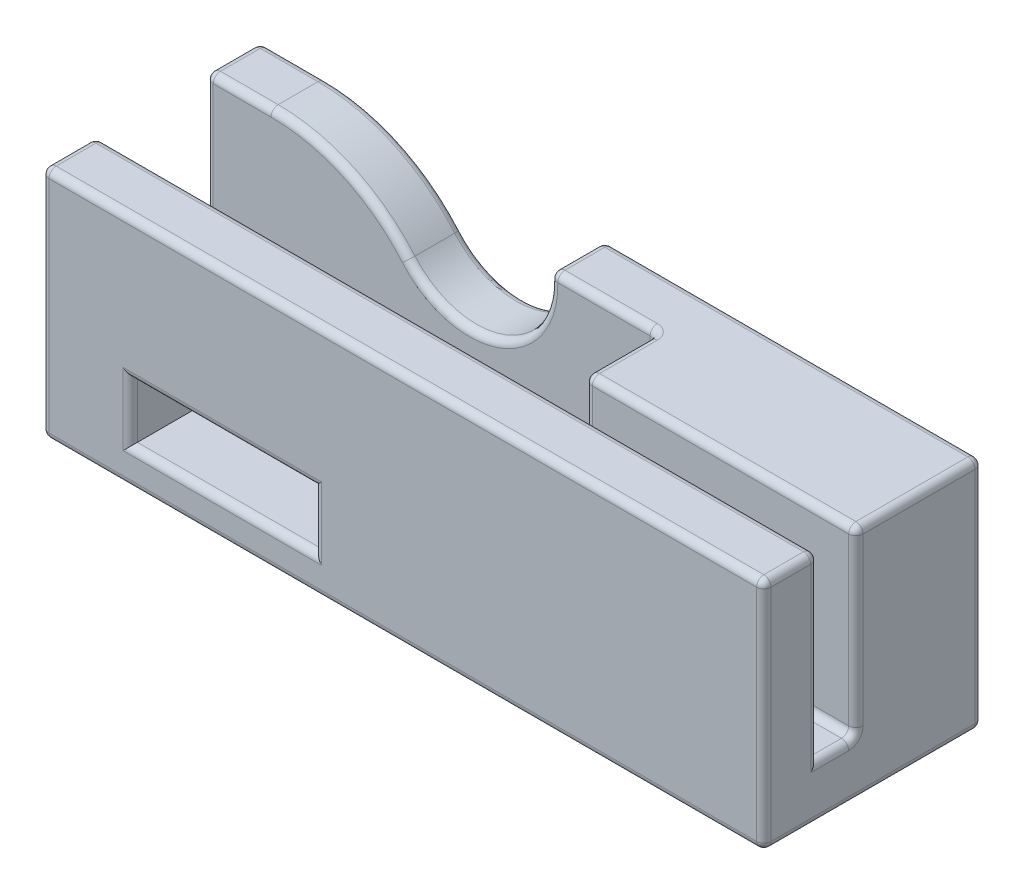
from build123d import *

# Parameters (mm, degrees)
SKETCH1_W           = 40
SKETCH1_H           = 12.1
BOSS_EXTRUDE1_DEPTH = 3
SKETCH2_W           = 40
SKETCH2_H           = 7
SKETCH2_H_2         = 3
BOSS_EXTRUDE2_DEPTH = 10
SKETCH3_W           = 10.2
SKETCH3_H           = 3.2
CUT_EXTRUDE1_DEPTH  = 44.765397291
SKETCH5_W           = 4
SKETCH5_H           = 10
CUT_EXTRUDE3_DEPTH  = 25
SKETCH6_R           = 4.5
CUT_EXTRUDE4_DEPTH  = 3
FILLET3_R           = 10
FILLET1_R           = 0.4


with BuildPart() as part:
    # Sketch1 → Boss-Extrude1 (new body)
    with BuildSketch(Plane(origin=(0, 0, 0), x_dir=(1, 0, 0), z_dir=(0, 1, 0))):
        with Locations((20, -6.05)):
            Rectangle(SKETCH1_W, SKETCH1_H)
    extrude(amount=BOSS_EXTRUDE1_DEPTH)

    # Sketch2 → Boss-Extrude2 (add)
    with BuildSketch(Plane(origin=(0, 3, 0), x_dir=(1, 0, 0), z_dir=(0, 1, 0))):
        with Locations((20, -3.5)):
            Rectangle(SKETCH2_W, SKETCH2_H)
        with Locations((20, -10.6)):
            Rectangle(SKETCH2_W, SKETCH2_H_2)
    extrude(amount=BOSS_EXTRUDE2_DEPTH)

    # Sketch3 → Cut-Extrude1 (cut, through all)
    with BuildSketch(Plane(origin=(0, 0, 0), x_dir=(-1, 0, 0), z_dir=(0, 0, -1))):
        with Locations((-10, 3.6)):
            Rectangle(SKETCH3_W, SKETCH3_H)
    extrude(amount=-CUT_EXTRUDE1_DEPTH, mode=Mode.SUBTRACT)

    # Sketch5 → Cut-Extrude3 (cut)
    with BuildSketch(Plane.ZY):
        with Locations((5, 8)):
            Rectangle(SKETCH5_W, SKETCH5_H)
    extrude(amount=-CUT_EXTRUDE3_DEPTH, mode=Mode.SUBTRACT)

    # Sketch6 → Cut-Extrude4 (cut)
    with BuildSketch(Plane(origin=(0, 0, 0), x_dir=(-1, 0, 0), z_dir=(0, 0, -1))):
        with Locations((-14.588737144, 12.45970207)):
            Circle(SKETCH6_R)
    extrude(amount=-CUT_EXTRUDE4_DEPTH, mode=Mode.SUBTRACT)

    # Fillet3
    fillet3_edges = [part.edges().sort_by_distance(p)[0] for p in [
        (10.121290653, 13, 1.5),
    ]]
    fillet(fillet3_edges, radius=FILLET3_R)

    # Fillet1
    fillet1_edges = [part.edges().sort_by_distance(p)[0] for p in [
        (0, 3, 6.05),
        (40, 8, 7),
        (0, 13, 1.5),
        (40, 13, 3.5),
        (29.528091817, 13, 0),
        (40, 3, 8.05),
        (0, 8, 9.1),
        (40, 8, 9.1),
        (0, 13, 10.6),
        (20, 13, 12.1),
        (40, 13, 10.6),
        (20, 13, 9.1),
        (15.1, 3.6, 12.1),
        (10, 5.2, 12.1),
        (4.9, 3.6, 12.1),
        (10, 2, 12.1),
        (15.1, 3.6, 0),
        (10, 2, 0),
        (4.9, 3.6, 0),
        (20, 0, 0),
        (10, 5.2, 0),
        (40, 0, 6.05),
        (20, 0, 12.1),
        (0, 0, 6.05),
        (32.5, 13, 7),
        (32.5, 3, 7),
        (25, 8, 7),
        (25, 3, 5),
        (25, 8, 3),
        (25, 13, 5),
        (22.028091817, 13, 3),
        (0, 8, 3),
        (0, 6.5, 0),
        (40, 6.5, 0),
        (40, 6.5, 12.1),
        (0, 6.5, 12.1),
        (16.405345244, 8.342672193, 3),
        (19.056183635, 13, 1.5),
        (16.405345244, 8.342672193, 0),
        (1.79973399, 13, 3),
        (7.768441198, 12.089535869, 3),
        (1.79973399, 13, 0),
        (7.768441198, 12.089535869, 0),
    ]]
    fillet(fillet1_edges, radius=FILLET1_R)


solid = part.part
